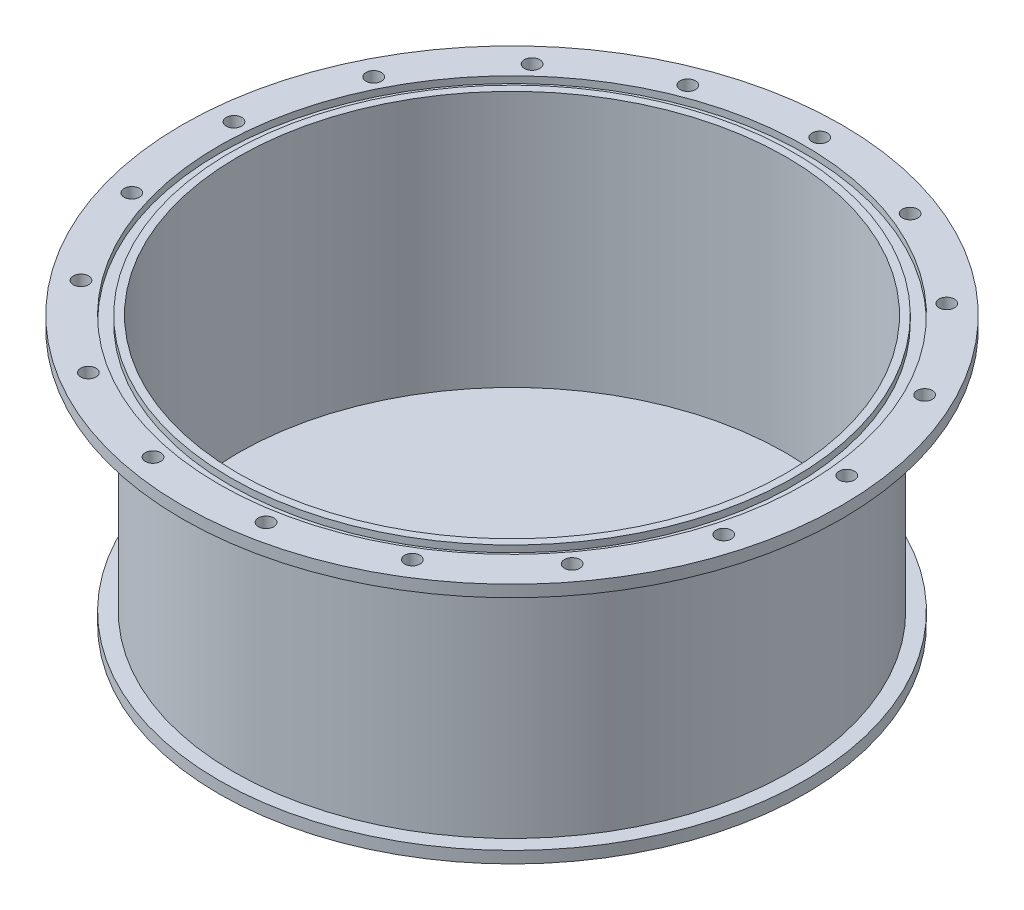
from build123d import *

# Parameters (mm, degrees)
SKETCH1_R           = 200
BOSS_EXTRUDE1_DEPTH = 8
SKETCH2_R           = 190
BOSS_EXTRUDE2_DEPTH = 175
SKETCH3_R           = 225
BOSS_EXTRUDE3_DEPTH = 8
SKETCH4_R           = 187
CUT_EXTRUDE1_DEPTH  = 175
SKETCH5_R           = 200
SKETCH5_R_2         = 192.2
CUT_EXTRUDE2_DEPTH  = 4.6
SKETCH6_R           = 5.25
CUT_EXTRUDE3_DEPTH  = 10
CIRPATTERN1_COUNT   = 17


with BuildPart() as part:
    # Sketch1 → Boss-Extrude1 (new body)
    with BuildSketch(Plane(origin=(0, 0, 0), x_dir=(1, 0, 0), z_dir=(0, 1, 0))):
        with Locations(Location((0, 0, 0), (0, 0, 270))):
            Circle(SKETCH1_R)
    extrude(amount=-BOSS_EXTRUDE1_DEPTH)

    # Sketch2 → Boss-Extrude2 (add)
    with BuildSketch(Plane(origin=(0, 0, 0), x_dir=(1, 0, 0), z_dir=(0, 1, 0))):
        with Locations(Location((0, 0, 0), (0, 0, 270))):
            Circle(SKETCH2_R)
    extrude(amount=BOSS_EXTRUDE2_DEPTH)

    # Sketch3 → Boss-Extrude3 (add)
    with BuildSketch(Plane(origin=(0, 175, 0), x_dir=(1, 0, 0), z_dir=(0, 1, 0))):
        with Locations(Location((0, 0, 0), (0, 0, 270))):
            Circle(SKETCH3_R)
    extrude(amount=-BOSS_EXTRUDE3_DEPTH)

    # Sketch4 → Cut-Extrude1 (cut)
    with BuildSketch(Plane(origin=(0, 175, 0), x_dir=(1, 0, 0), z_dir=(0, 1, 0))):
        with Locations(Location((0, 0, 0), (0, 0, 270))):
            Circle(SKETCH4_R)
    extrude(amount=-CUT_EXTRUDE1_DEPTH, mode=Mode.SUBTRACT)

    # Sketch5 → Cut-Extrude2 (cut)
    with BuildSketch(Plane(origin=(0, 175, 0), x_dir=(1, 0, 0), z_dir=(0, 1, 0))):
        with Locations(Location((0, 0, 0), (0, 0, 270))):
            Circle(SKETCH5_R)
        with Locations(Location((0, 0, 0), (0, 0, 270))):
            Circle(SKETCH5_R_2, mode=Mode.SUBTRACT)
    extrude(amount=-CUT_EXTRUDE2_DEPTH, mode=Mode.SUBTRACT)

    # Sketch6 → Cut-Extrude3 (cut)
    with BuildSketch(Plane(origin=(0, 175, 0), x_dir=(1, 0, 0), z_dir=(0, 1, 0))):
        with Locations(Location((0, 210, 0), (0, 0, 270))):
            Circle(SKETCH6_R)
    cut_extrude3 = extrude(amount=-CUT_EXTRUDE3_DEPTH, mode=Mode.SUBTRACT)

    # CirPattern1: Cut-Extrude3 ×17 about axis
    cirpattern1_axis = Axis((0, 0, 0), (0, 1, 0))
    for i in range(1, CIRPATTERN1_COUNT):
        add(cut_extrude3.rotate(cirpattern1_axis, i * 360 / CIRPATTERN1_COUNT), mode=Mode.SUBTRACT)


solid = part.part
